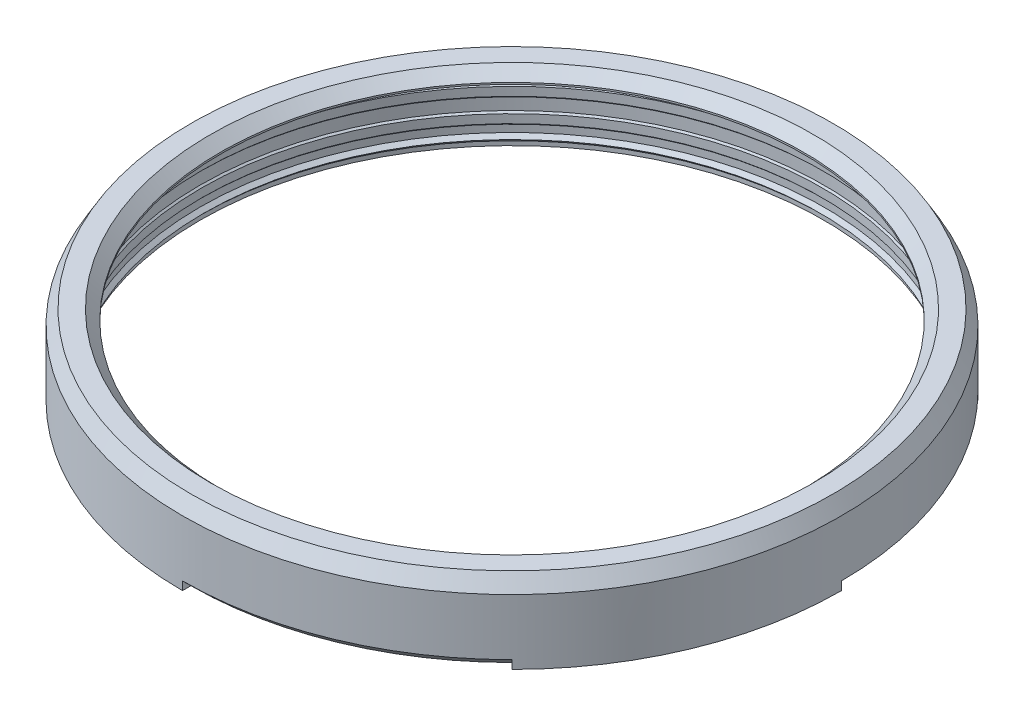
from build123d import *

# Parameters (mm, degrees)
SKETCH_1_R               = 39
EXTRUDE_1_DEPTH          = 2
SKETCH_3_R               = 34.5
CUT_EXTRUDE_1_DEPTH      = 57.053545829
CUT_EXTRUDE_START        = -0.6
SKETCH_4_R               = 39
CUT_EXTRUDE_2_DEPTH      = 0.6
CHAMFER_1_SIZE           = 1.732
CHAMFER_1_SIZE2          = 0.999970666
CHAMFER_2_SIZE           = 1.2
CUT_REVOLVE_1_ANGLE      = 45
PATTERN_CIRCULAR_1_COUNT = 4
SKETCH_6_R               = 35.78
SKETCH_6_R_2             = 35.32
EXTRUDE_2_DEPTH          = 0.5


with BuildPart() as part:
    # 草图1 → 凸台-拉伸1 (new body)
    with BuildSketch(Plane(origin=(0, 0, 0), x_dir=(1, 0, 0), z_dir=(0, 1, 0))):
        with Locations(Location((0, 0, 0), (0, 0, 270))):
            Circle(SKETCH_1_R)
    extrude(amount=EXTRUDE_1_DEPTH)

    # 草图2 → 旋转1 (revolve)
    with BuildSketch(Plane(origin=(0, 0, 0), x_dir=(0.5000000000000016, 0, 0.8660254037844378), z_dir=(-0.8660254037844377, 0, 0.5000000000000014)), mode=Mode.PRIVATE) as revolve_1_sk:
        with BuildLine():
            Line((36.93, -8), (36.93, -7.5))
            Line((36.93, -7.5), (36.505, -7.075))
            Line((36.505, -7.075), (36.93, -6.65))
            Line((36.93, -6.65), (36.93, -5.8))
            Line((36.93, -5.8), (36.74, -5.61))
            Line((36.74, -5.61), (36.74, -4.59))
            Line((36.74, -4.59), (36.93, -4.4))
            Line((36.93, -4.4), (36.93, -3))
            Line((36.93, -3), (36.74, -2.81))
            Line((36.74, -2.81), (36.74, -1.79))
            Line((36.74, -1.79), (36.93, -1.6))
            Line((36.93, -1.6), (36.93, -1.4))
            ThreePointArc((36.93, -1.4), (36.519949494, -0.410050506), (35.53, 0))
            Line((35.53, 0), (39, 0))
            Line((39, 0), (39, -8))
            Line((39, -8), (36.93, -8))
        make_face()
    revolve(revolve_1_sk.sketch.rotate(Axis((0, 0, 0), (0, 1, 0)), 60), axis=Axis((0, 0, 0), (0, 1, 0)))

    # 草图3 → 切除-拉伸1 (cut, through all)
    with BuildSketch(Plane(origin=(0, 2, 0), x_dir=(1, 0, 0), z_dir=(0, 1, 0))):
        with Locations(Location((0, 0, 0), (0, 0, 270))):
            Circle(SKETCH_3_R)
    extrude(amount=-CUT_EXTRUDE_1_DEPTH, mode=Mode.SUBTRACT)

    # 草图4 → 切除-拉伸2 (cut)
    with BuildSketch(Plane(origin=(0, 2, 0), x_dir=(1, 0, 0), z_dir=(0, 1, 0)).offset(CUT_EXTRUDE_START)):
        Circle(SKETCH_4_R)
    extrude(amount=CUT_EXTRUDE_2_DEPTH, mode=Mode.SUBTRACT)

    # 倒角1
    chamfer_1_edges = [part.edges().sort_by_distance(p)[0] for p in [
        (0, 1.4, -39),
    ]]
    chamfer_1_side = [part.faces().sort_by_distance(p)[0] for p in [
        (-27.577164466, -3.3, -27.577164466),
    ]]
    chamfer(chamfer_1_edges, length=CHAMFER_1_SIZE, length2=CHAMFER_1_SIZE2, reference=chamfer_1_side[0])

    # 倒角2
    chamfer_2_edges = [part.edges().sort_by_distance(p)[0] for p in [
        (0, 1.4, -34.5),
    ]]
    chamfer(chamfer_2_edges, length=CHAMFER_2_SIZE)

    # 草图5 → 切除-旋转1 (revolve, cut)
    with BuildSketch(Plane.XY):
        Polygon((39, -8), (39, -7), (38, -8), align=None)
    cut_revolve_1 = revolve(axis=Axis((0, 0, 0), (0, 1, 0)), revolution_arc=CUT_REVOLVE_1_ANGLE, mode=Mode.SUBTRACT)

    # 阵列(圆周)1: 切除-旋转1 ×4 about axis
    pattern_circular_1_axis = Axis((0, 0, 0), (0, 1, 0))
    for i in range(1, PATTERN_CIRCULAR_1_COUNT):
        add(cut_revolve_1.rotate(pattern_circular_1_axis, i * 360 / PATTERN_CIRCULAR_1_COUNT), mode=Mode.SUBTRACT)

    # 草图6 → 凸台-拉伸2 (add)
    with BuildSketch(Plane.XZ):
        Circle(SKETCH_6_R)
        with Locations(Location((0, 0, 0), (0, 0, 270))):
            Circle(SKETCH_6_R_2, mode=Mode.SUBTRACT)
    extrude(amount=EXTRUDE_2_DEPTH)


solid = part.part
